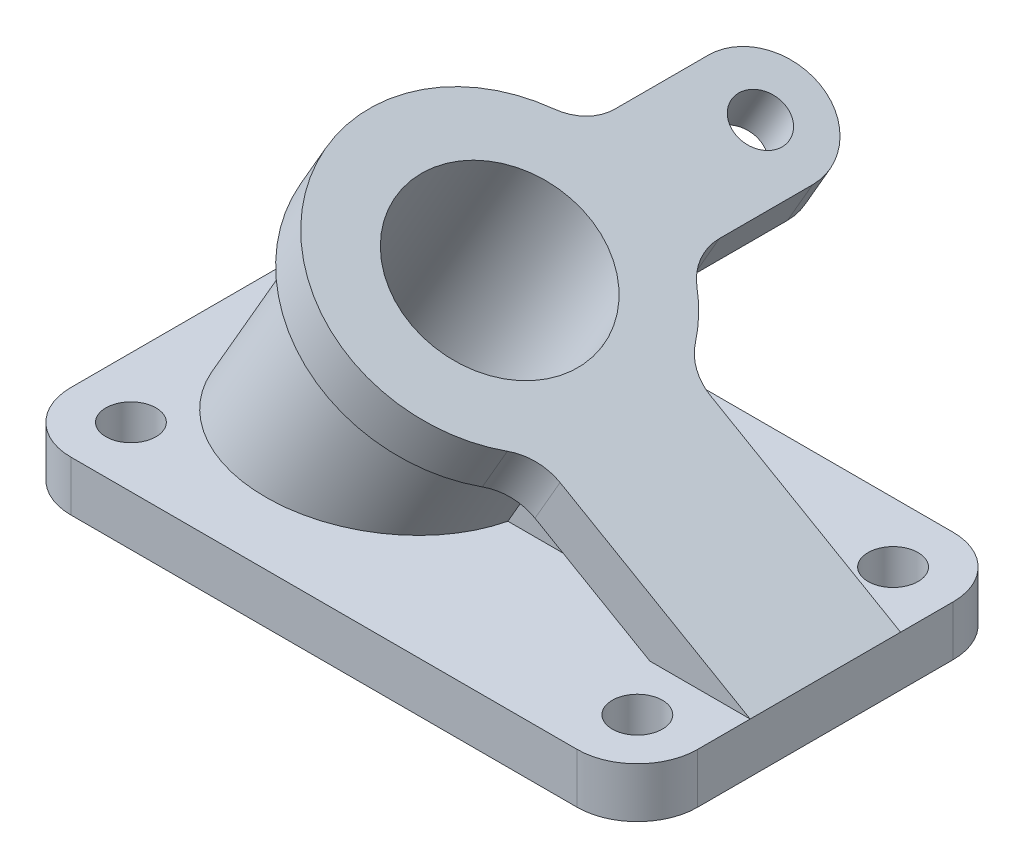
from build123d import *

# Parameters (mm, degrees)
SKETCH_1_R               = 5
EXTRUDE_1_DEPTH          = 10
SKETCH_3_R               = 25
SKETCH_3_R_2             = 5
EXTRUDE_4_DEPTH          = 10
EXTRUDE_5_REACH          = 111.952
SKETCH_11_R              = 25
CUT_EXTRUDE_5_DEPTH      = 110.952122557
CUT_EXTRUDE_5_DEPTH_BACK = 110.952122557
SKETCH_13_R              = 18
RIB_2_REACH              = 111.126
SKETCH_14_WALL_W         = 252.93163968
SKETCH_14_WALL_H         = 10
CUT_EXTRUDE_6_DEPTH      = 110.126073878
CUT_EXTRUDE_6_DEPTH_BACK = 5
RIB_3_REACH              = 119.31
SKETCH_18_WALL_W         = 268.526863554
SKETCH_18_WALL_H         = 10


with BuildPart() as part:
    # 草图1 → 凸台-拉伸1 (new body)
    with BuildSketch(Plane(origin=(0, 0, 0), x_dir=(1, 0, 0), z_dir=(0, 1, 0))):
        with BuildLine():
            Line((-50.5, 37.5), (50.5, 37.5))
            ThreePointArc((50.5, 37.5), (58.985281374, 33.985281374), (62.5, 25.5))
            Line((62.5, 25.5), (62.5, -25.5))
            ThreePointArc((62.5, -25.5), (58.985281374, -33.985281374), (50.5, -37.5))
            Line((50.5, -37.5), (-50.5, -37.5))
            ThreePointArc((-50.5, -37.5), (-58.985281374, -33.985281374), (-62.5, -25.5))
            Line((-62.5, -25.5), (-62.5, 25.5))
            ThreePointArc((-62.5, 25.5), (-58.985281374, 33.985281374), (-50.5, 37.5))
        make_face()
        with Locations(Location((50.5, -25.5, 0), (0, 0, 270))):
            Circle(SKETCH_1_R, mode=Mode.SUBTRACT)
        with Locations(Location((50.5, 25.5, 0), (0, 0, 270))):
            Circle(SKETCH_1_R, mode=Mode.SUBTRACT)
        with Locations(Location((-50.5, 25.5, 0), (0, 0, 270))):
            Circle(SKETCH_1_R, mode=Mode.SUBTRACT)
        with Locations(Location((-50.5, -25.5, 0), (0, 0, 270))):
            Circle(SKETCH_1_R, mode=Mode.SUBTRACT)
    extrude(amount=EXTRUDE_1_DEPTH)

    # 草图3 → 凸台-拉伸4 (add)
    with BuildSketch(Plane(origin=(19.955127019, 34.563293868, 0), x_dir=(0, 0, -1), z_dir=(0.500000000000001, 0.866025403784438, 0))):
        with BuildLine():
            Line((-15, -49.126587737), (15, -49.126587737))
            Line((15, -49.126587737), (15, -5.351577729))
            ThreePointArc((15, -5.351577729), (15.986121811, -1.02145071), (18.75, 2.454669769))
            ThreePointArc((18.75, 2.454669769), (22.173981002, 5.666617205), (25.054939633, 9.373412263))
            ThreePointArc((25.054939633, 9.373412263), (28.663169687, 12.676820694), (33.406586177, 13.873412263))
            Line((33.406586177, 13.873412263), (52, 13.873412263))
            ThreePointArc((52, 13.873412263), (64, 25.873412263), (52, 37.873412263))
            Line((52, 37.873412263), (33.406586177, 37.873412263))
            ThreePointArc((33.406586177, 37.873412263), (28.663169687, 39.070003833), (25.054939633, 42.373412263))
            ThreePointArc((25.054939633, 42.373412263), (-20.206795058, 48.047393266), (-18.75, 2.454669769))
            ThreePointArc((-18.75, 2.454669769), (-15.986121811, -1.02145071), (-15, -5.351577729))
            Line((-15, -5.351577729), (-15, -49.126587737))
        make_face()
        with Locations(Location((0, 25.873412263, 0), (0, 0, 90))):
            Circle(SKETCH_3_R, mode=Mode.SUBTRACT)
        with Locations(Location((52, 25.873412263, 0), (0, 0, 90))):
            Circle(SKETCH_3_R_2, mode=Mode.SUBTRACT)
    extrude(amount=-EXTRUDE_4_DEPTH)

    # 凸台-拉伸5: up to this plane
    extrude_5_end = Plane(origin=(50.5, 10, -25.5), z_dir=(0, -1, 0))
    # 草图11 → 凸台-拉伸5 (add, up to the surface)
    with BuildSketch(Plane(origin=(19.955127019, 34.563293868, 0), x_dir=(0.8660254037844382, -0.500000000000001, 0), z_dir=(0.500000000000001, 0.8660254037844382, 0)), mode=Mode.PRIVATE) as extrude_5_sk1:
        with Locations(Location((-25.873412263, 0, 0), (0, 0, 180))):
            Circle(SKETCH_11_R)
    extrude_5_tool1 = split(extrude(extrude_5_sk1.sketch, amount=-EXTRUDE_5_REACH, mode=Mode.PRIVATE), bisect_by=extrude_5_end, keep=Keep.BOTH, mode=Mode.PRIVATE)
    add(extrude_5_tool1.solids().sort_by_distance((-2.451905, 47.5, 0))[0])

    # 草图13 → 切除-拉伸5 (cut, two sides: drawn at the far end of the back side and taken through both)
    with BuildSketch(Plane(origin=(19.955127019, 34.563293868, 0), x_dir=(0, 0, -1), z_dir=(0.500000000000001, 0.866025403784438, 0)).offset(-CUT_EXTRUDE_5_DEPTH_BACK)):
        with Locations(Location((0, 25.873412263, 0), (0, 0, 90))):
            Circle(SKETCH_13_R)
    extrude(amount=CUT_EXTRUDE_5_DEPTH + CUT_EXTRUDE_5_DEPTH_BACK, mode=Mode.SUBTRACT)

    # 草图14 wall → 筋2 (add, up to next)
    with BuildSketch(Plane(origin=(28.349364905, 18.169872981, 0), x_dir=(0.866025403785, -0.499999999999, 0), z_dir=(0.499999999999, 0.866025403785, 0)), mode=Mode.PRIVATE) as rib_2_sk1:
        Rectangle(SKETCH_14_WALL_W, SKETCH_14_WALL_H)
    rib_2_tool1 = extrude(rib_2_sk1.sketch, amount=-RIB_2_REACH, mode=Mode.PRIVATE) - part.part
    add(rib_2_tool1.solids().sort_by_distance((28.349364905, 18.169872981, 0))[0])

    # 草图15 → 切除-拉伸6 (cut, two sides: drawn at the far end of the back side and taken through both)
    with BuildSketch(Plane.XZ.offset(-CUT_EXTRUDE_6_DEPTH_BACK)):
        with BuildLine():
            Line((-41.457999039, 25.5), (41.457999039, 25.5))
            ThreePointArc((41.457999039, 25.5), (44.106339805, 19.106339805), (50.5, 16.457999039))
            Line((50.5, 16.457999039), (50.5, -16.457999039))
            ThreePointArc((50.5, -16.457999039), (44.106339805, -19.106339805), (41.457999039, -25.5))
            Line((41.457999039, -25.5), (-41.457999039, -25.5))
            ThreePointArc((-41.457999039, -25.5), (-44.106339805, -19.106339805), (-50.5, -16.457999039))
            Line((-50.5, -16.457999039), (-50.5, 16.457999039))
            ThreePointArc((-50.5, 16.457999039), (-44.106339805, 19.106339805), (-41.457999039, 25.5))
        make_face()
    extrude(amount=CUT_EXTRUDE_6_DEPTH + CUT_EXTRUDE_6_DEPTH_BACK, mode=Mode.SUBTRACT)

    # 草图18 wall → 筋3 (add, up to next)
    with BuildSketch(Plane(origin=(-14.201905284, 27.148403011, -33.5), x_dir=(-0.423116420047, -0.732859137032, 0.532813269688), z_dir=(-0.266406634844, -0.461429827024, -0.846232840088)), mode=Mode.PRIVATE) as rib_3_sk1:
        Rectangle(SKETCH_18_WALL_W, SKETCH_18_WALL_H)
    rib_3_tool1 = extrude(rib_3_sk1.sketch, amount=-RIB_3_REACH, mode=Mode.PRIVATE) - part.part
    add(rib_3_tool1.solids().sort_by_distance((-14.201905284, 27.148403011, -33.5))[0])


solid = part.part
